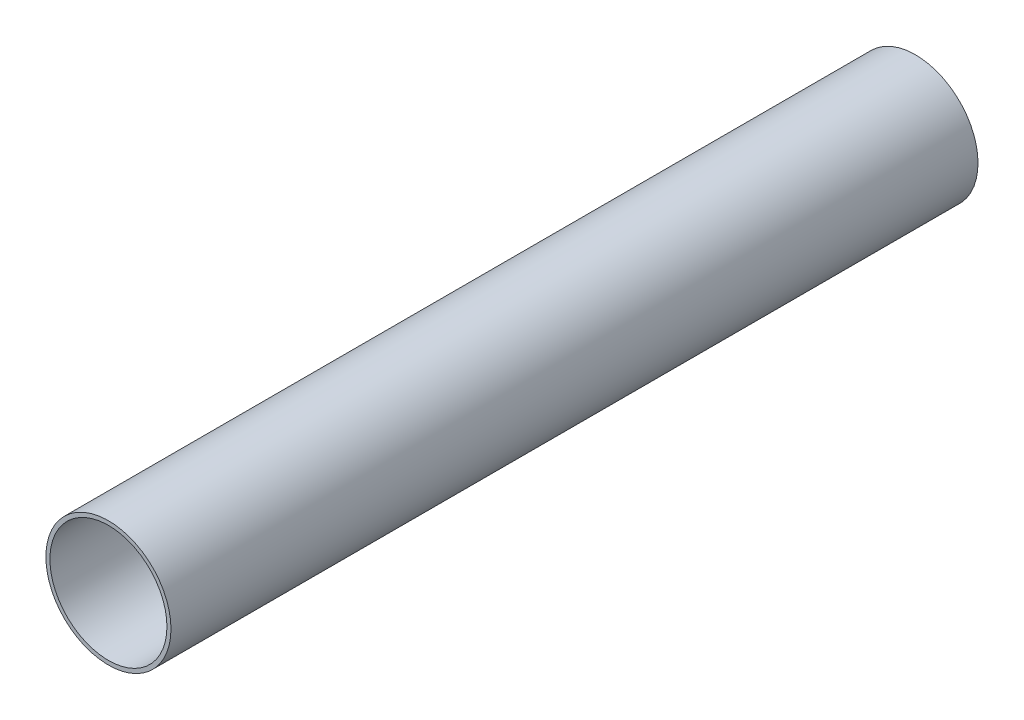
from build123d import *

# Parameters (mm, degrees)
SKETCH1_R           = 15.5
SKETCH1_R_2         = 14.5
BOSS_EXTRUDE2_DEPTH = 200


with BuildPart() as part:
    # Sketch1 → Boss-Extrude2 (new body)
    with BuildSketch(Plane.XY):
        with Locations((-9.329058629, 10.495190958)):
            Circle(SKETCH1_R)
        with Locations((-9.329058629, 10.495190958)):
            Circle(SKETCH1_R_2, mode=Mode.SUBTRACT)
    extrude(amount=BOSS_EXTRUDE2_DEPTH)


solid = part.part
